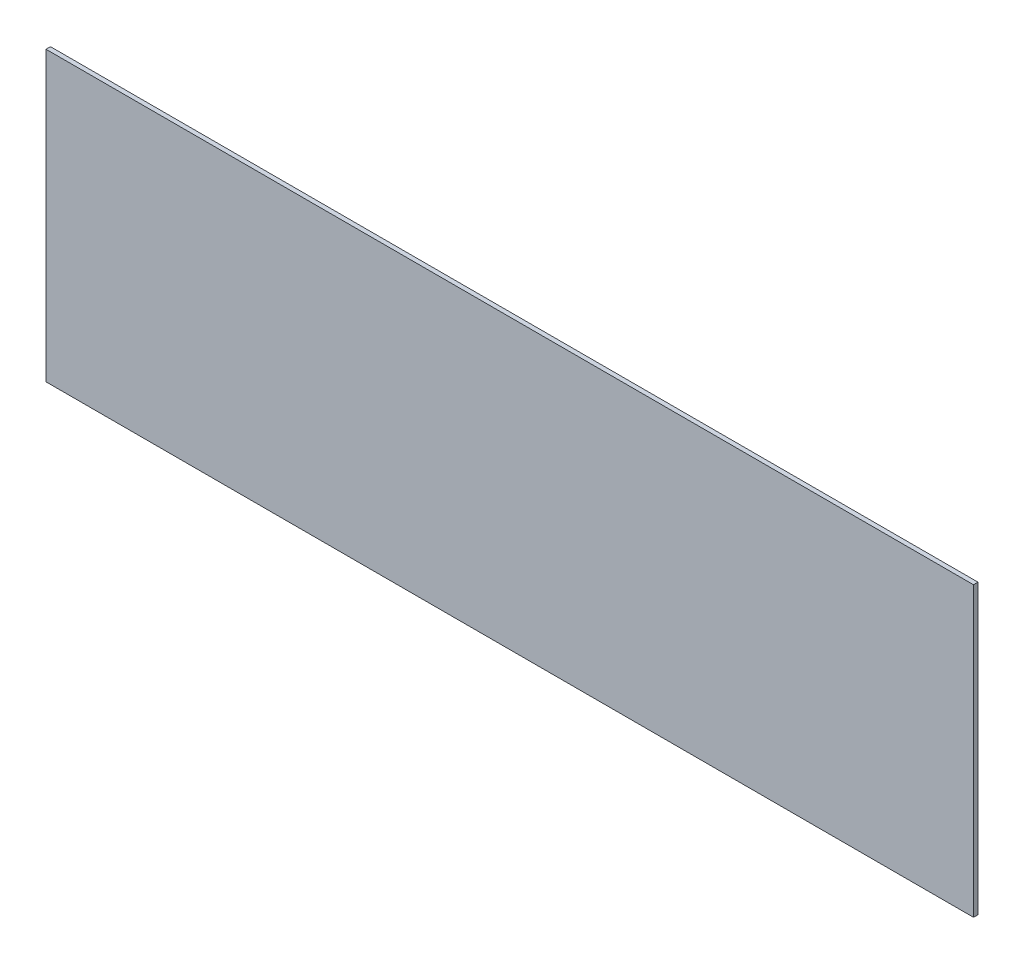
from build123d import *

# Parameters (mm, degrees)
SKETCH1_W           = 657.606
SKETCH1_H           = 204.216
BOSS_EXTRUDE1_DEPTH = 3.175


with BuildPart() as part:
    # Sketch1 → Boss-Extrude1 (new body)
    with BuildSketch(Plane.XY):
        with Locations((-328.803, 102.108)):
            Rectangle(SKETCH1_W, SKETCH1_H)
    extrude(amount=BOSS_EXTRUDE1_DEPTH)


solid = part.part
